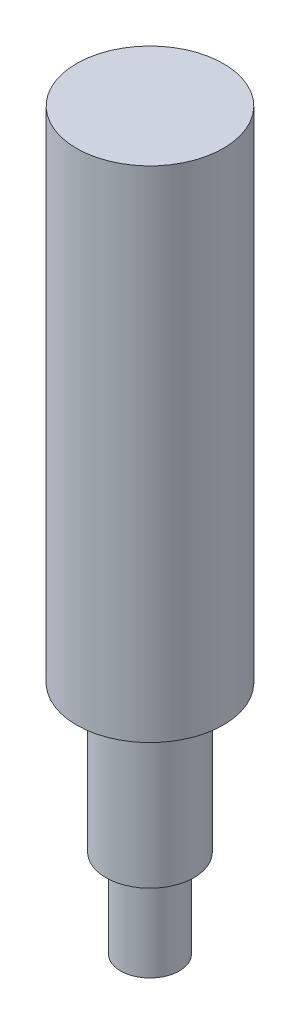
from build123d import *

# Parameters (mm, degrees)
M4_THREAD_BLANK_SKETCH_R = 2
M4_THREAD_BLANK_DEPTH    = 6
LOCATING_SPIGOT_SKETCH_R = 3
LOCATING_SPIGOT_DEPTH    = 10
GUIDE_SHOULDER_SKETCH_R  = 5
GUIDE_SHOULDER_DEPTH     = 34


with BuildPart() as part:
    # M4 Thread Blank Sketch → M4 Thread Blank (new body)
    with BuildSketch(Plane(origin=(0, -140, 0), x_dir=(1, 0, 0), z_dir=(0, 1, 0))):
        with Locations(Location((-20.291651246, 0, 0), (0, 0, 270))):
            Circle(M4_THREAD_BLANK_SKETCH_R)
    extrude(amount=M4_THREAD_BLANK_DEPTH)

    # Locating Spigot Sketch → Locating Spigot (add)
    with BuildSketch(Plane(origin=(0, -134, 0), x_dir=(1, 0, 0), z_dir=(0, 1, 0))):
        with Locations(Location((-20.291651246, 0, 0), (0, 0, 270))):
            Circle(LOCATING_SPIGOT_SKETCH_R)
    extrude(amount=LOCATING_SPIGOT_DEPTH)

    # Guide Shoulder Sketch → Guide Shoulder (add)
    with BuildSketch(Plane(origin=(0, -124, 0), x_dir=(1, 0, 0), z_dir=(0, 1, 0))):
        with Locations(Location((-20.291651246, 0, 0), (0, 0, 270))):
            Circle(GUIDE_SHOULDER_SKETCH_R)
    extrude(amount=GUIDE_SHOULDER_DEPTH)


solid = part.part
